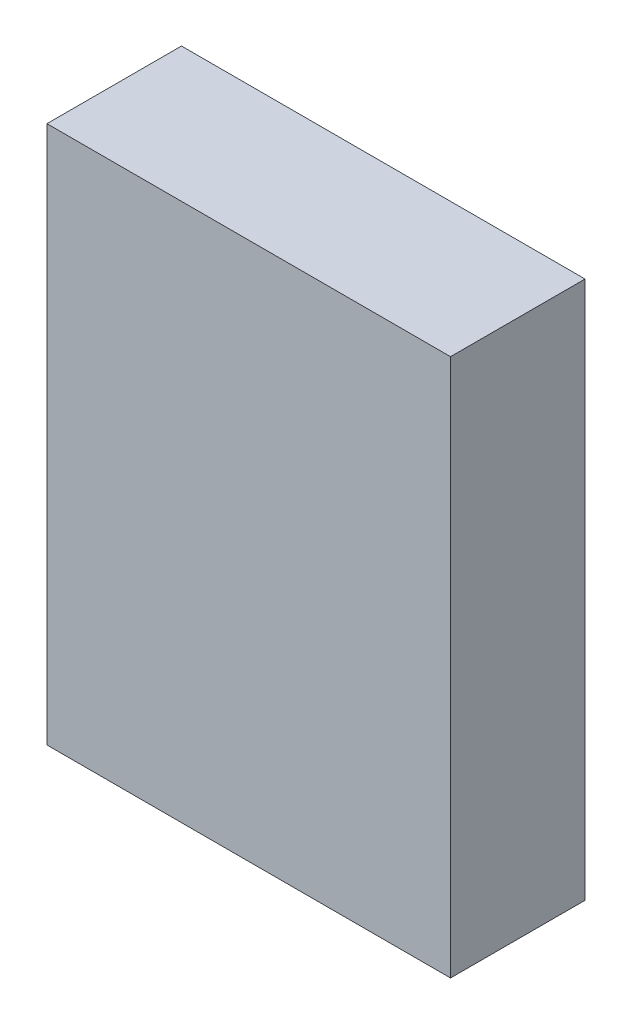
from build123d import *

# Parameters (mm, degrees)
CROQUIS1_W              = 15
CROQUIS1_H              = 20
SALIENTE_EXTRUIR1_DEPTH = 5


with BuildPart() as part:
    # Croquis1 → Saliente-Extruir1 (new body)
    with BuildSketch(Plane.XY):
        with Locations((0.905797101, 6.050724638)):
            Rectangle(CROQUIS1_W, CROQUIS1_H)
    extrude(amount=SALIENTE_EXTRUIR1_DEPTH)


solid = part.part
